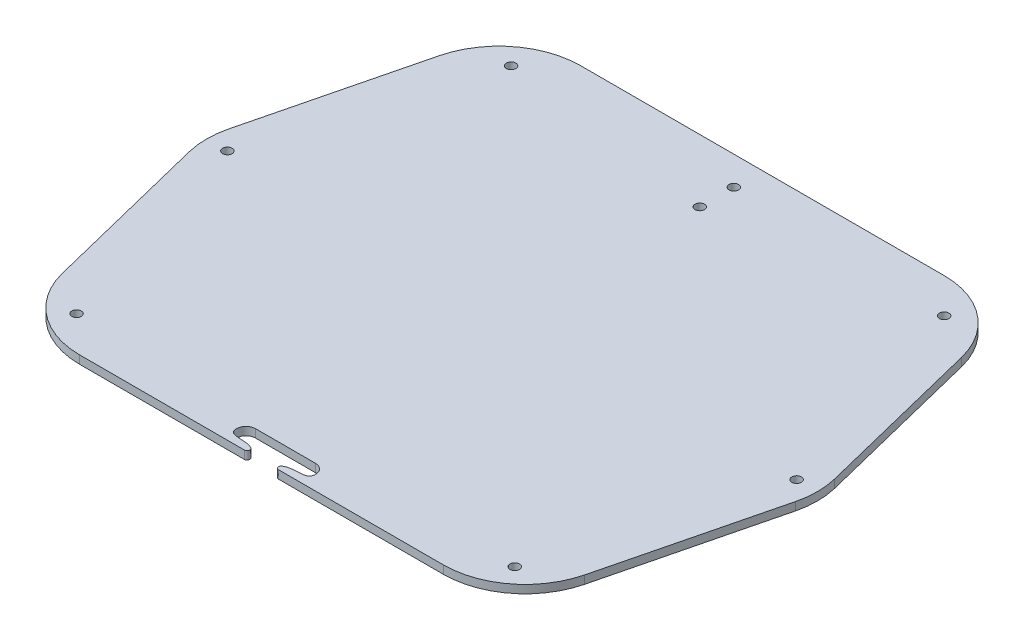
from build123d import *

# Parameters (mm, degrees)
EXTRUDE_1_DEPTH     = 3
SKETCH_2_R          = 1.75
CUT_EXTRUDE_1_DEPTH = 10
SKETCH_3_R          = 1.75
CUT_EXTRUDE_2_DEPTH = 10
SKETCH_4_R          = 1.75
CUT_EXTRUDE_3_DEPTH = 10
CUT_EXTRUDE_4_DEPTH = 10


with BuildPart() as part:
    # 草图1 → 凸台-拉伸1 (new body)
    with BuildSketch(Plane(origin=(0, 0, 0), x_dir=(1, 0, 0), z_dir=(0, 1, 0))):
        with BuildLine():
            Line((-66.78059141, 154.593992167), (66.78059141, 154.593992167))
            ThreePointArc((66.78059141, 154.593992167), (85.265515034, 148.222525736), (95.898700635, 131.814498742))
            Line((95.898700635, 131.814498742), (111.265547961, 69.844672358))
            ThreePointArc((111.265547961, 69.844672358), (112.147438737, 62.624165782), (111.265547961, 55.403659207))
            Line((111.265547961, 55.403659207), (95.898700635, -6.566167178))
            ThreePointArc((95.898700635, -6.566167178), (85.265515034, -22.974194171), (66.78059141, -29.345660602))
            Line((66.78059141, -29.345660602), (-66.78059141, -29.345660602))
            ThreePointArc((-66.78059141, -29.345660602), (-85.265515034, -22.974194171), (-95.898700635, -6.566167178))
            Line((-95.898700635, -6.566167178), (-111.265547961, 55.403659207))
            ThreePointArc((-111.265547961, 55.403659207), (-112.147438737, 62.624165782), (-111.265547961, 69.844672358))
            Line((-111.265547961, 69.844672358), (-95.898700635, 131.814498742))
            ThreePointArc((-95.898700635, 131.814498742), (-85.265515034, 148.222525736), (-66.78059141, 154.593992167))
        make_face()
    extrude(amount=EXTRUDE_1_DEPTH)

    # 草图2 → 切除-拉伸1 (cut)
    with BuildSketch(Plane(origin=(0, 3, 0), x_dir=(1, 0, 0), z_dir=(0, 1, 0))):
        with Locations(Location((-104.507530951, 62.624165782, 0), (0, 0, 270))):
            Circle(SKETCH_2_R)
        with Locations(Location((-80.450184708, -16.818951307, 0), (0, 0, 270))):
            Circle(SKETCH_2_R)
        with Locations(Location((104.507530951, 62.624165782, 0), (0, 0, 270))):
            Circle(SKETCH_2_R)
        with Locations(Location((80.450184708, -16.818951307, 0), (0, 0, 270))):
            Circle(SKETCH_2_R)
    extrude(amount=-CUT_EXTRUDE_1_DEPTH, mode=Mode.SUBTRACT)

    # 草图3 → 切除-拉伸2 (cut)
    with BuildSketch(Plane(origin=(0, 3, 0), x_dir=(1, 0, 0), z_dir=(0, 1, 0))):
        with Locations(Location((0, 131.568155221, 0), (0, 0, 270))):
            Circle(SKETCH_3_R)
        with Locations(Location((0, 144.079729864, 0), (0, 0, 270))):
            Circle(SKETCH_3_R)
    extrude(amount=-CUT_EXTRUDE_2_DEPTH, mode=Mode.SUBTRACT)

    # 草图4 → 切除-拉伸3 (cut)
    with BuildSketch(Plane(origin=(0, 3, 0), x_dir=(1, 0, 0), z_dir=(0, 1, 0))):
        with Locations(Location((-79.5, 141.78226533, 0), (0, 0, 270))):
            Circle(SKETCH_4_R)
        with Locations(Location((79.5, 141.78226533, 0), (0, 0, 270))):
            Circle(SKETCH_4_R)
    extrude(amount=-CUT_EXTRUDE_3_DEPTH, mode=Mode.SUBTRACT)

    # 草图5 → 切除-拉伸4 (cut)
    with BuildSketch(Plane(origin=(0, 3, 0), x_dir=(1, 0, 0), z_dir=(0, 1, 0))):
        with BuildLine():
            Line((11.016648097, -20.513898252), (-11.016648097, -20.513898252))
            ThreePointArc((-11.016648097, -20.513898252), (-13.814702514, -21.911306641), (-14.378457093, -24.987674549))
            add(Edge.make_bspline(
                [(-14.378457093, -24.987674549), (-14.050661547, -26.11933694), (-10.489346867, -26.76009099), (-7.724749574, -26.493757466), (-5.904508816, -27.417302496), (-5.804576355, -27.473305111)],
                knots=[0, 0, 0, 0, 0.274123853, 0.745489655, 0.777393608, 0.777393608, 0.777393608, 0.777393608], degree=3))
            ThreePointArc((-5.804576355, -27.473305111), (-5.325885634, -28.59829127), (-6.293448421, -29.345660602))
            Line((-6.293448421, -29.345660602), (6.293448421, -29.345660602))
            ThreePointArc((6.293448421, -29.345660602), (5.325885634, -28.59829127), (5.804576355, -27.473305111))
            add(Edge.make_bspline(
                [(5.804576355, -27.473305111), (5.904508816, -27.417302496), (7.724749574, -26.493757466), (10.489346867, -26.76009099), (14.050661547, -26.11933694), (14.378457093, -24.987674549)],
                knots=[0, 0, 0, 0, 0.031903952, 0.503269754, 0.777393608, 0.777393608, 0.777393608, 0.777393608], degree=3))
            ThreePointArc((14.378457093, -24.987674549), (13.814702514, -21.911306641), (11.016648097, -20.513898252))
        make_face()
    extrude(amount=-CUT_EXTRUDE_4_DEPTH, mode=Mode.SUBTRACT)


solid = part.part
